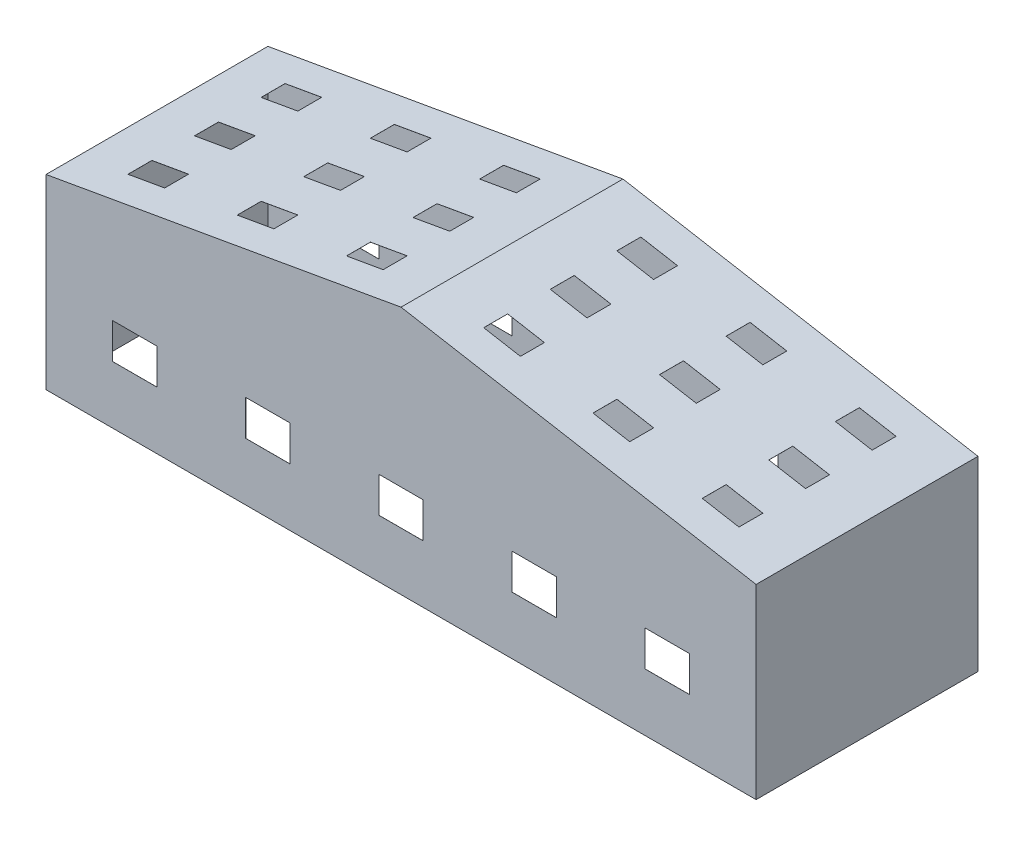
from build123d import *

# Parameters (mm, degrees)
SKETCH2_W               = 16000
SKETCH2_H               = 5000
BOSS_EXTRUDE1_DEPTH     = 4200
BOSS_EXTRUDE2_DEPTH     = 2500
SHELL1_T                = -1
CUT_EXTRUDE1_REACH      = 10978.293
SKETCH4_W               = 1000
SKETCH4_H               = 800
LPATTERN1_COUNT         = 3
LPATTERN1_PITCH         = 3000
MIRROR1_COPY_1_REACH    = 10978.293
MIRROR1_COPY_1_SKETCH_W = 1000
MIRROR1_COPY_1_SKETCH_H = 800
MIRROR1_COPY_2_REACH    = 10978.293
MIRROR1_COPY_2_SKETCH_W = 1000
MIRROR1_COPY_2_SKETCH_H = 800
MIRROR4_COPY_1_REACH    = 10978.293
MIRROR4_COPY_1_SKETCH_W = 1000
MIRROR4_COPY_1_SKETCH_H = 800
MIRROR4_COPY_2_REACH    = 10978.293
MIRROR4_COPY_2_SKETCH_W = 1000
MIRROR4_COPY_2_SKETCH_H = 800
MIRROR4_COPY_3_REACH    = 10978.293
MIRROR4_COPY_3_SKETCH_W = 1000
MIRROR4_COPY_3_SKETCH_H = 800
MIRROR4_COPY_4_REACH    = 10978.293
MIRROR4_COPY_4_SKETCH_W = 1000
MIRROR4_COPY_4_SKETCH_H = 800
SKETCH5_W               = 840
SKETCH5_H               = 540
CUT_EXTRUDE2_DEPTH      = 1
LPATTERN2_COUNT         = 3
LPATTERN2_PITCH         = 1500
LPATTERN2_COUNT_DIR2    = 3
LPATTERN2_PITCH_DIR2    = 2500
MIRROR9_COPY_1_SKETCH_W = 840
MIRROR9_COPY_1_SKETCH_H = 540
MIRROR9_COPY_1_DEPTH    = 1
MIRROR9_COPY_2_SKETCH_W = 840
MIRROR9_COPY_2_SKETCH_H = 540
MIRROR9_COPY_2_DEPTH    = 1
MIRROR9_COPY_3_SKETCH_W = 840
MIRROR9_COPY_3_SKETCH_H = 540
MIRROR9_COPY_3_DEPTH    = 1
MIRROR9_COPY_4_SKETCH_W = 840
MIRROR9_COPY_4_SKETCH_H = 540
MIRROR9_COPY_4_DEPTH    = 1
MIRROR9_COPY_5_SKETCH_W = 840
MIRROR9_COPY_5_SKETCH_H = 540
MIRROR9_COPY_5_DEPTH    = 1
MIRROR9_COPY_6_SKETCH_W = 840
MIRROR9_COPY_6_SKETCH_H = 540
MIRROR9_COPY_6_DEPTH    = 1
MIRROR9_COPY_7_SKETCH_W = 840
MIRROR9_COPY_7_SKETCH_H = 540
MIRROR9_COPY_7_DEPTH    = 1
MIRROR9_COPY_8_SKETCH_W = 840
MIRROR9_COPY_8_SKETCH_H = 540
MIRROR9_COPY_8_DEPTH    = 1


with BuildPart() as part:
    # Sketch2 → Boss-Extrude1 (new body)
    with BuildSketch(Plane(origin=(0, 0, 0), x_dir=(1, 0, 0), z_dir=(0, 1, 0))):
        Rectangle(SKETCH2_W, SKETCH2_H)
    extrude(amount=BOSS_EXTRUDE1_DEPTH)

    # Sketch3 → Boss-Extrude2 (add, symmetric)
    with BuildSketch(Plane.XY):
        Polygon((-8000, 4200), (0, 5610.615845668), (8000, 4200), align=None)
    extrude(amount=BOSS_EXTRUDE2_DEPTH, both=True)

    # Shell1
    shell1_openings = [part.faces().sort_by_distance(p)[0] for p in [
        (0, 0, 0),
    ]]
    offset(amount=SHELL1_T, openings=shell1_openings, kind=Kind.INTERSECTION)

    # Sketch4 → Cut-Extrude1 (cut, up to next)
    with BuildSketch(Plane.XY.offset(2500), mode=Mode.PRIVATE) as cut_extrude1_sk1:
        with Locations((0, 1700)):
            Rectangle(SKETCH4_W, SKETCH4_H)
    cut_extrude1_tool1 = extrude(cut_extrude1_sk1.sketch, amount=-CUT_EXTRUDE1_REACH, mode=Mode.PRIVATE) & part.part
    cut_extrude1 = cut_extrude1_tool1.solids().sort_by_distance((0, 1700, 2500))[0]
    add(cut_extrude1, mode=Mode.SUBTRACT)

    # LPattern1: Cut-Extrude1 ×3
    with Locations(*[(-i * LPATTERN1_PITCH, 0, 0) for i in range(1, LPATTERN1_COUNT)]):
        add(cut_extrude1, mode=Mode.SUBTRACT)

    # Mirror1 copy 1 sketch → Mirror1 copy 1 (cut, up to next)
    with BuildSketch(Plane(origin=(3000, 0, 2500), x_dir=(-1, 0, 0), z_dir=(0, 0, 1)), mode=Mode.PRIVATE) as mirror1_copy_1_sk1:
        with Locations((0, -1700)):
            Rectangle(MIRROR1_COPY_1_SKETCH_W, MIRROR1_COPY_1_SKETCH_H)
    mirror1_copy_1_tool1 = extrude(mirror1_copy_1_sk1.sketch, amount=-MIRROR1_COPY_1_REACH, mode=Mode.PRIVATE) & part.part
    add(mirror1_copy_1_tool1.solids().sort_by_distance((3000, 1700, 2500))[0], mode=Mode.SUBTRACT)

    # Mirror1 copy 2 sketch → Mirror1 copy 2 (cut, up to next)
    with BuildSketch(Plane(origin=(6000, 0, 2500), x_dir=(-1, 0, 0), z_dir=(0, 0, 1)), mode=Mode.PRIVATE) as mirror1_copy_2_sk1:
        with Locations((0, -1700)):
            Rectangle(MIRROR1_COPY_2_SKETCH_W, MIRROR1_COPY_2_SKETCH_H)
    mirror1_copy_2_tool1 = extrude(mirror1_copy_2_sk1.sketch, amount=-MIRROR1_COPY_2_REACH, mode=Mode.PRIVATE) & part.part
    add(mirror1_copy_2_tool1.solids().sort_by_distance((6000, 1700, 2500))[0], mode=Mode.SUBTRACT)

    # Mirror4: Cut-Extrude1 across plane
    add(cut_extrude1.mirror(Plane.XY), mode=Mode.SUBTRACT)

    # Mirror4 copy 1 sketch → Mirror4 copy 1 (cut, up to next)
    with BuildSketch(Plane(origin=(-3000, 0, -2500), x_dir=(1, 0, 0), z_dir=(0, 0, -1)), mode=Mode.PRIVATE) as mirror4_copy_1_sk1:
        with Locations((0, -1700)):
            Rectangle(MIRROR4_COPY_1_SKETCH_W, MIRROR4_COPY_1_SKETCH_H)
    mirror4_copy_1_tool1 = extrude(mirror4_copy_1_sk1.sketch, amount=-MIRROR4_COPY_1_REACH, mode=Mode.PRIVATE) & part.part
    add(mirror4_copy_1_tool1.solids().sort_by_distance((-3000, 1700, -2500))[0], mode=Mode.SUBTRACT)

    # Mirror4 copy 2 sketch → Mirror4 copy 2 (cut, up to next)
    with BuildSketch(Plane(origin=(-6000, 0, -2500), x_dir=(1, 0, 0), z_dir=(0, 0, -1)), mode=Mode.PRIVATE) as mirror4_copy_2_sk1:
        with Locations((0, -1700)):
            Rectangle(MIRROR4_COPY_2_SKETCH_W, MIRROR4_COPY_2_SKETCH_H)
    mirror4_copy_2_tool1 = extrude(mirror4_copy_2_sk1.sketch, amount=-MIRROR4_COPY_2_REACH, mode=Mode.PRIVATE) & part.part
    add(mirror4_copy_2_tool1.solids().sort_by_distance((-6000, 1700, -2500))[0], mode=Mode.SUBTRACT)

    # Mirror4 copy 3 sketch → Mirror4 copy 3 (cut, up to next)
    with BuildSketch(Plane(origin=(3000, 0, -2500), x_dir=(-1, 0, 0), z_dir=(0, 0, -1)), mode=Mode.PRIVATE) as mirror4_copy_3_sk1:
        with Locations((0, 1700)):
            Rectangle(MIRROR4_COPY_3_SKETCH_W, MIRROR4_COPY_3_SKETCH_H)
    mirror4_copy_3_tool1 = extrude(mirror4_copy_3_sk1.sketch, amount=-MIRROR4_COPY_3_REACH, mode=Mode.PRIVATE) & part.part
    add(mirror4_copy_3_tool1.solids().sort_by_distance((3000, 1700, -2500))[0], mode=Mode.SUBTRACT)

    # Mirror4 copy 4 sketch → Mirror4 copy 4 (cut, up to next)
    with BuildSketch(Plane(origin=(6000, 0, -2500), x_dir=(-1, 0, 0), z_dir=(0, 0, -1)), mode=Mode.PRIVATE) as mirror4_copy_4_sk1:
        with Locations((0, 1700)):
            Rectangle(MIRROR4_COPY_4_SKETCH_W, MIRROR4_COPY_4_SKETCH_H)
    mirror4_copy_4_tool1 = extrude(mirror4_copy_4_sk1.sketch, amount=-MIRROR4_COPY_4_REACH, mode=Mode.PRIVATE) & part.part
    add(mirror4_copy_4_tool1.solids().sort_by_distance((6000, 1700, -2500))[0], mode=Mode.SUBTRACT)

    # Sketch5 → Cut-Extrude2 (cut)
    with BuildSketch(Plane(origin=(959.47181784, 5441.435076953, 0), x_dir=(0.9848077530122079, -0.17364817766693114, 0), z_dir=(0.17364817766693114, 0.9848077530122079, 0))):
        with Locations((595.726782811, 1500)):
            Rectangle(SKETCH5_W, SKETCH5_H)
    cut_extrude2 = extrude(amount=-CUT_EXTRUDE2_DEPTH, mode=Mode.SUBTRACT)

    # LPattern2: Cut-Extrude2 3 × 3
    with Locations(*[Vector(0, 0, 1) * (i * LPATTERN2_PITCH) + Vector(0.9848077530122079, -0.17364817766693114, 0) * (j * LPATTERN2_PITCH_DIR2) for i in range(LPATTERN2_COUNT) for j in range(LPATTERN2_COUNT_DIR2) if (i, j) != (0, 0)]):
        add(cut_extrude2, mode=Mode.SUBTRACT)

    # Mirror9: Cut-Extrude2 across plane
    add(cut_extrude2.mirror(Plane(origin=(0, 0, 0), x_dir=(0, 0, 1), z_dir=(1, 0, 0))), mode=Mode.SUBTRACT)

    # Mirror9 copy 1 sketch → Mirror9 copy 1 (cut)
    with BuildSketch(Plane(origin=(-3421.491200371, 5007.314632786, 0), x_dir=(-0.9848077530122079, -0.17364817766693114, 0), z_dir=(-0.17364817766693114, 0.9848077530122079, 0))):
        with Locations((595.726782811, -1500)):
            Rectangle(MIRROR9_COPY_1_SKETCH_W, MIRROR9_COPY_1_SKETCH_H)
    extrude(amount=-MIRROR9_COPY_1_DEPTH, mode=Mode.SUBTRACT)

    # Mirror9 copy 2 sketch → Mirror9 copy 2 (cut)
    with BuildSketch(Plane(origin=(-5883.510582901, 4573.194188618, 0), x_dir=(-0.9848077530122079, -0.17364817766693114, 0), z_dir=(-0.17364817766693114, 0.9848077530122079, 0))):
        with Locations((595.726782811, -1500)):
            Rectangle(MIRROR9_COPY_2_SKETCH_W, MIRROR9_COPY_2_SKETCH_H)
    extrude(amount=-MIRROR9_COPY_2_DEPTH, mode=Mode.SUBTRACT)

    # Mirror9 copy 3 sketch → Mirror9 copy 3 (cut)
    with BuildSketch(Plane(origin=(-959.47181784, 5441.435076953, 1500), x_dir=(-0.9848077530122079, -0.17364817766693114, 0), z_dir=(-0.17364817766693114, 0.9848077530122079, 0))):
        with Locations((595.726782811, -1500)):
            Rectangle(MIRROR9_COPY_3_SKETCH_W, MIRROR9_COPY_3_SKETCH_H)
    extrude(amount=-MIRROR9_COPY_3_DEPTH, mode=Mode.SUBTRACT)

    # Mirror9 copy 4 sketch → Mirror9 copy 4 (cut)
    with BuildSketch(Plane(origin=(-3421.491200371, 5007.314632786, 1500), x_dir=(-0.9848077530122079, -0.17364817766693114, 0), z_dir=(-0.17364817766693114, 0.9848077530122079, 0))):
        with Locations((595.726782811, -1500)):
            Rectangle(MIRROR9_COPY_4_SKETCH_W, MIRROR9_COPY_4_SKETCH_H)
    extrude(amount=-MIRROR9_COPY_4_DEPTH, mode=Mode.SUBTRACT)

    # Mirror9 copy 5 sketch → Mirror9 copy 5 (cut)
    with BuildSketch(Plane(origin=(-5883.510582901, 4573.194188618, 1500), x_dir=(-0.9848077530122079, -0.17364817766693114, 0), z_dir=(-0.17364817766693114, 0.9848077530122079, 0))):
        with Locations((595.726782811, -1500)):
            Rectangle(MIRROR9_COPY_5_SKETCH_W, MIRROR9_COPY_5_SKETCH_H)
    extrude(amount=-MIRROR9_COPY_5_DEPTH, mode=Mode.SUBTRACT)

    # Mirror9 copy 6 sketch → Mirror9 copy 6 (cut)
    with BuildSketch(Plane(origin=(-959.47181784, 5441.435076953, 3000), x_dir=(-0.9848077530122079, -0.17364817766693114, 0), z_dir=(-0.17364817766693114, 0.9848077530122079, 0))):
        with Locations((595.726782811, -1500)):
            Rectangle(MIRROR9_COPY_6_SKETCH_W, MIRROR9_COPY_6_SKETCH_H)
    extrude(amount=-MIRROR9_COPY_6_DEPTH, mode=Mode.SUBTRACT)

    # Mirror9 copy 7 sketch → Mirror9 copy 7 (cut)
    with BuildSketch(Plane(origin=(-3421.491200371, 5007.314632786, 3000), x_dir=(-0.9848077530122079, -0.17364817766693114, 0), z_dir=(-0.17364817766693114, 0.9848077530122079, 0))):
        with Locations((595.726782811, -1500)):
            Rectangle(MIRROR9_COPY_7_SKETCH_W, MIRROR9_COPY_7_SKETCH_H)
    extrude(amount=-MIRROR9_COPY_7_DEPTH, mode=Mode.SUBTRACT)

    # Mirror9 copy 8 sketch → Mirror9 copy 8 (cut)
    with BuildSketch(Plane(origin=(-5883.510582901, 4573.194188618, 3000), x_dir=(-0.9848077530122079, -0.17364817766693114, 0), z_dir=(-0.17364817766693114, 0.9848077530122079, 0))):
        with Locations((595.726782811, -1500)):
            Rectangle(MIRROR9_COPY_8_SKETCH_W, MIRROR9_COPY_8_SKETCH_H)
    extrude(amount=-MIRROR9_COPY_8_DEPTH, mode=Mode.SUBTRACT)


solid = part.part
